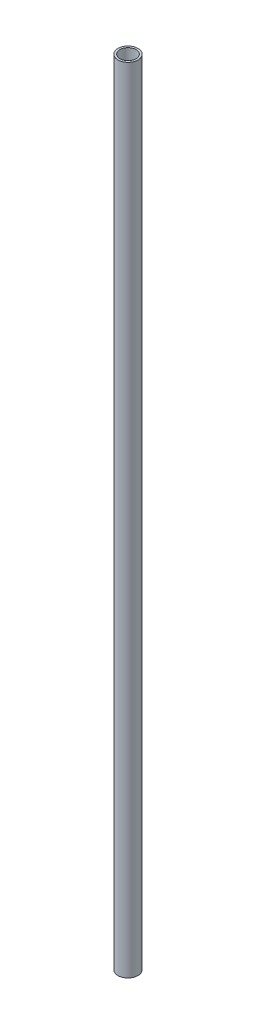
from build123d import *

# Parameters (mm, degrees)
SKETCH_1_R      = 10
SKETCH_1_R_2    = 8
EXTRUDE_1_DEPTH = 791.6


with BuildPart() as part:
    # 草图1 → 凸台-拉伸1 (new body)
    with BuildSketch(Plane(origin=(0, 0, 0), x_dir=(1, 0, 0), z_dir=(0, 1, 0))):
        with Locations(Location((0, 0, 0), (0, 0, 270))):
            Circle(SKETCH_1_R)
        with Locations(Location((0, 0, 0), (0, 0, 270))):
            Circle(SKETCH_1_R_2, mode=Mode.SUBTRACT)
    extrude(amount=EXTRUDE_1_DEPTH)


solid = part.part
